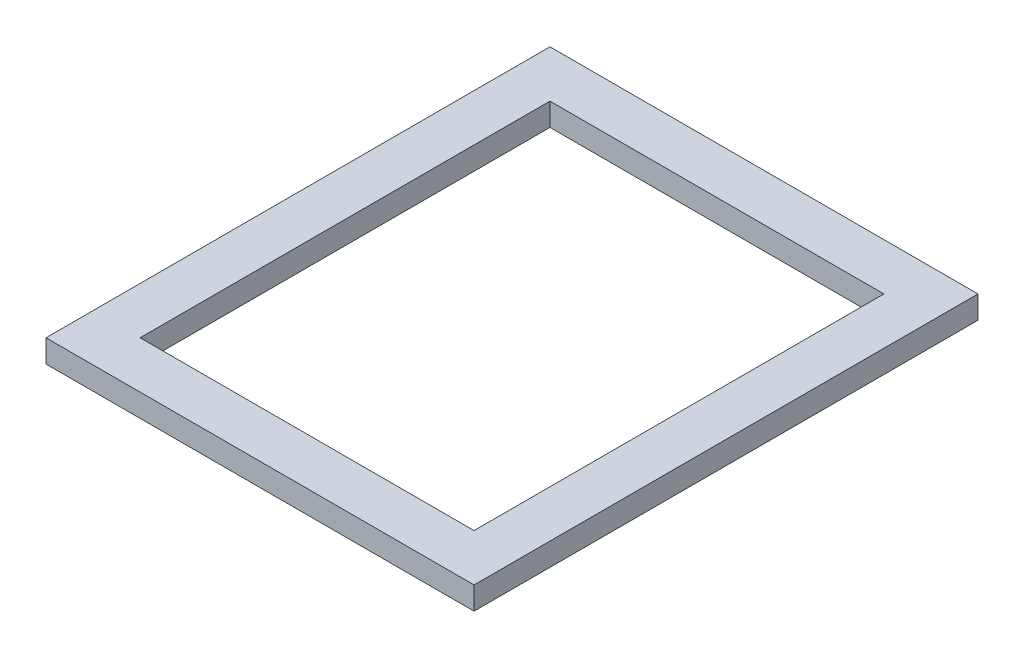
from build123d import *

# Parameters (mm, degrees)
SKETCH1_W    = 28.2
SKETCH1_H    = 33.2
SKETCH1_W_2  = 22
SKETCH1_H_2  = 27
GASKET_DEPTH = 1.5


with BuildPart() as part:
    # Sketch1 → Gasket (new body)
    with BuildSketch(Plane(origin=(0, 0, 0), x_dir=(1, 0, 0), z_dir=(0, 1, 0))):
        Rectangle(SKETCH1_W, SKETCH1_H)
        Rectangle(SKETCH1_W_2, SKETCH1_H_2, mode=Mode.SUBTRACT)
    extrude(amount=GASKET_DEPTH)


solid = part.part
